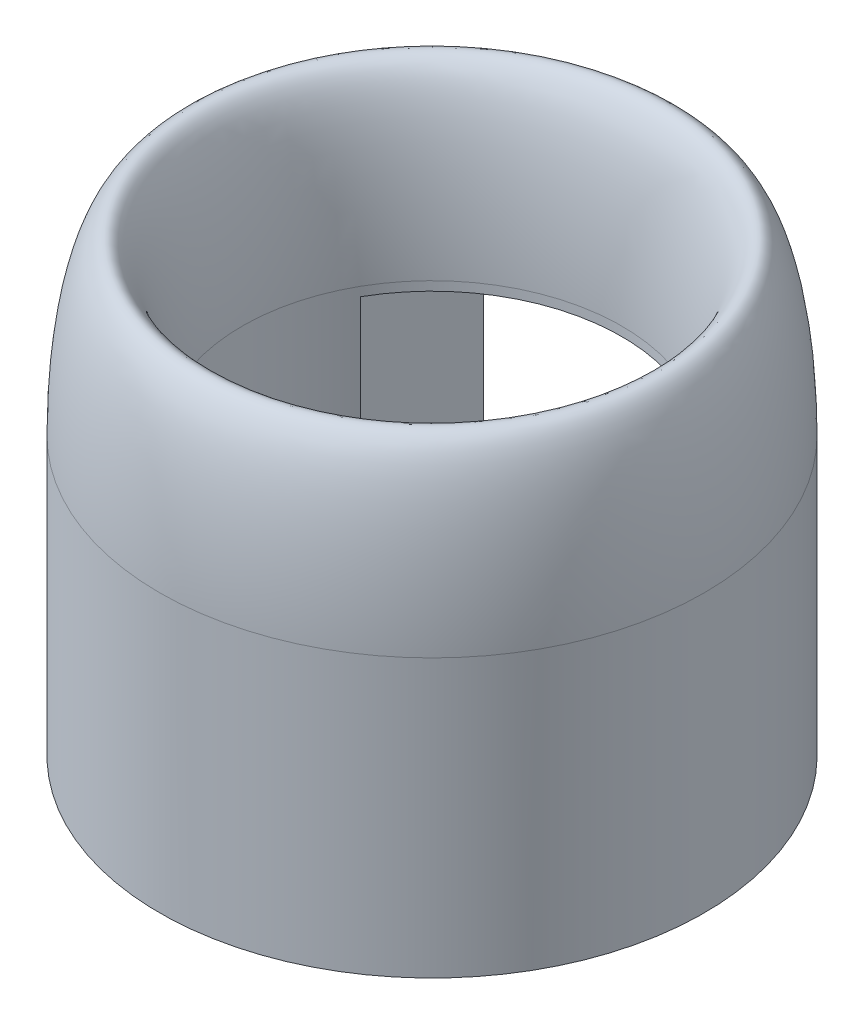
from build123d import *

# Parameters (mm, degrees)
SKETCH1_R           = 25
SKETCH1_R_2         = 1.8
SKETCH1_R_3         = 5.5
BOSS_EXTRUDE1_DEPTH = 7.5
SKETCH2_R           = 4
CUT_EXTRUDE1_DEPTH  = 6
BOSS_EXTRUDE2_START = -7.5
SKETCH3_R           = 33
SKETCH3_R_2         = 23
BOSS_EXTRUDE2_DEPTH = 47
SKETCH3_2_R         = 33
SKETCH3_2_R_2       = 23
BOSS_EXTRUDE3_DEPTH = 7.5
SKETCH7_W           = 40
SKETCH7_H           = 21.642183308
CUT_EXTRUDE3_DEPTH  = 25


with BuildPart() as part:
    # Sketch1 → Boss-Extrude1 (new body)
    with BuildSketch(Plane(origin=(0, 0, 0), x_dir=(1, 0, 0), z_dir=(0, 1, 0))):
        with Locations(Location((0, 0, 0), (0, 0, 270))):
            Circle(SKETCH1_R)
        with Locations(Location((-19, 0, 0), (0, 0, 270))):
            Circle(SKETCH1_R_2, mode=Mode.SUBTRACT)
        with Locations(Location((19, 0, 0), (0, 0, 90))):
            Circle(SKETCH1_R_2, mode=Mode.SUBTRACT)
        with Locations(Location((0, 0, 0), (0, 0, 270))):
            Circle(SKETCH1_R_3, mode=Mode.SUBTRACT)
    extrude(amount=BOSS_EXTRUDE1_DEPTH)

    # Sketch2 → Cut-Extrude1 (cut)
    with BuildSketch(Plane(origin=(0, 7.5, 0), x_dir=(1, 0, 0), z_dir=(0, 1, 0))):
        with Locations(Location((-19, 0, 0), (0, 0, 270))):
            Circle(SKETCH2_R)
        with Locations(Location((19, 0, 0), (0, 0, 270))):
            Circle(SKETCH2_R)
    extrude(amount=-CUT_EXTRUDE1_DEPTH, mode=Mode.SUBTRACT)

    # Sketch3 → Boss-Extrude2 (add)
    with BuildSketch(Plane.XZ.offset(BOSS_EXTRUDE2_START)):
        with Locations(Location((0, 0, 0), (0, 0, 90))):
            Circle(SKETCH3_R)
        with Locations(Location((0, 0, 0), (0, 0, 180.000077522))):
            Circle(SKETCH3_R_2, mode=Mode.SUBTRACT)
    extrude(amount=-BOSS_EXTRUDE2_DEPTH)

    # Sketch3<2> → Boss-Extrude3 (add)
    with BuildSketch(Plane.XZ):
        with Locations(Location((0, 0, 0), (0, 0, 270))):
            Circle(SKETCH3_2_R)
        with Locations(Location((0, 0, 0), (0, 0, 180.000077522))):
            Circle(SKETCH3_2_R_2, mode=Mode.SUBTRACT)
    extrude(amount=-BOSS_EXTRUDE3_DEPTH)

    # Sketch6 → Cut-Revolve7 (revolve, cut)
    with BuildSketch(Plane.XY, mode=Mode.PRIVATE) as cut_revolve7_sk:
        with BuildLine():
            Line((-33, 33.6), (-33, 54.5))
            Line((-33, 54.5), (-23, 54.5))
            Line((-23, 54.5), (-23, 33.6))
            add(Edge.make_bspline(
                [(-23, 33.6), (-23, 54.4), (-28, 54.4), (-33, 54.4), (-33, 33.6)],
                knots=[1.570796327, 1.570796327, 1.570796327, 3.141592654, 3.141592654, 4.71238898, 4.71238898, 4.71238898], degree=2, weights=[1, 0.707106781, 1, 0.707106781, 1]))
        make_face()
    revolve(cut_revolve7_sk.sketch.rotate(Axis((0, 54.5, 0), (0, -1, 0)), 90), axis=Axis((0, 54.5, 0), (0, -1, 0)), mode=Mode.SUBTRACT)

    # Sketch7 → Cut-Extrude3 (cut)
    with BuildSketch(Plane(origin=(0, 7.5, 0), x_dir=(1, 0, 0), z_dir=(0, 1, 0))):
        with Locations((0, 22.178908346)):
            Rectangle(SKETCH7_W, SKETCH7_H)
    extrude(amount=CUT_EXTRUDE3_DEPTH, mode=Mode.SUBTRACT)


solid = part.part
